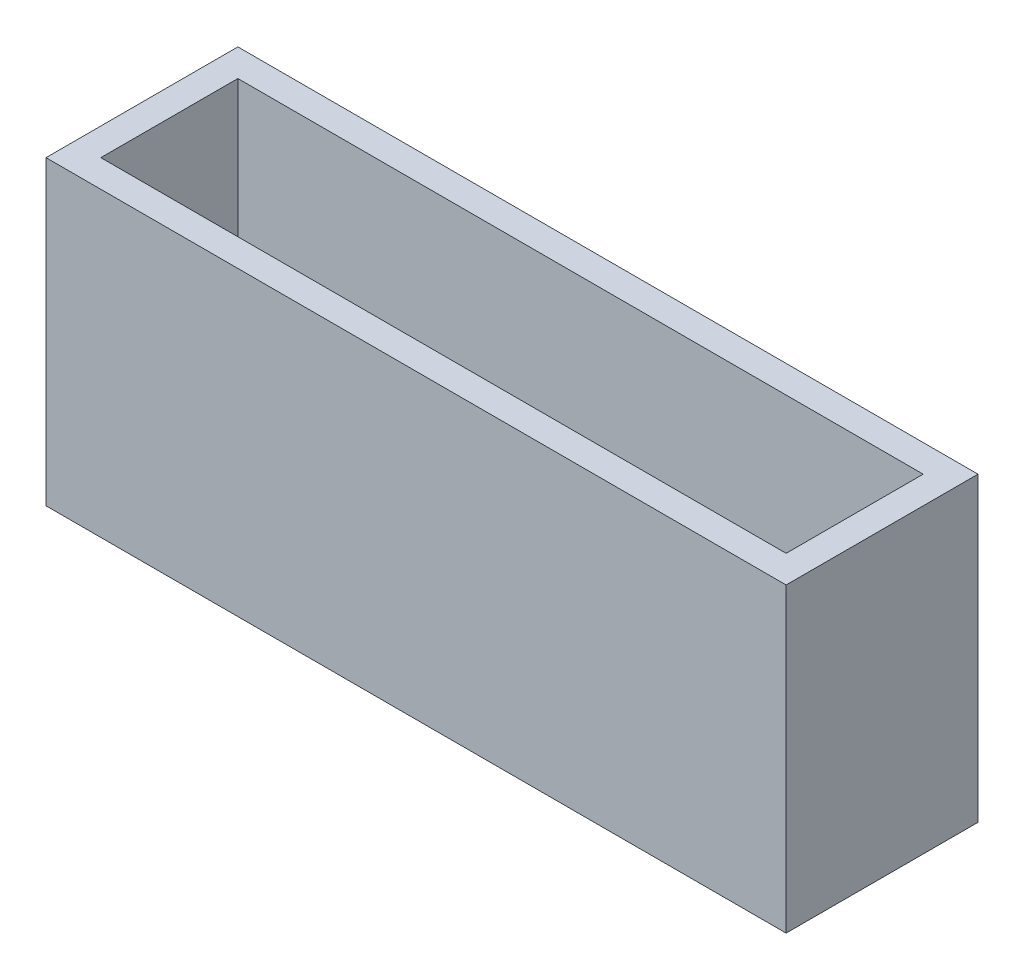
from build123d import *

# Parameters (mm, degrees)
SKETCH3_W           = 54
SKETCH3_H           = 14
SKETCH3_W_2         = 50
SKETCH3_H_2         = 10
BOSS_EXTRUDE1_DEPTH = 22
SKETCH4_W           = 7
SKETCH4_H           = 10
SKETCH4_R           = 1
BOSS_EXTRUDE2_DEPTH = 2


with BuildPart() as part:
    # Sketch3 → Boss-Extrude1 (new body)
    with BuildSketch(Plane(origin=(0, 0, 0), x_dir=(1, 0, 0), z_dir=(0, 1, 0))):
        Rectangle(SKETCH3_W, SKETCH3_H)
        Rectangle(SKETCH3_W_2, SKETCH3_H_2, mode=Mode.SUBTRACT)
    extrude(amount=BOSS_EXTRUDE1_DEPTH)

    # Sketch4 → Boss-Extrude2 (add)
    # profile 1 of 2: a face of its own
    with BuildSketch(Plane(origin=(0, 0, 0), x_dir=(1, 0, 0), z_dir=(0, 1, 0))):
        with Locations((-21.5, 0)):
            Rectangle(SKETCH4_W, SKETCH4_H)
        with Locations(Location((-21.5, 0, 0), (0, 0, 270))):
            Circle(SKETCH4_R, mode=Mode.SUBTRACT)
    # profile 2 of 2: a face of its own
    with BuildSketch(Plane(origin=(0, 0, 0), x_dir=(1, 0, 0), z_dir=(0, 1, 0))):
        with Locations((21.5, 0)):
            Rectangle(SKETCH4_W, SKETCH4_H)
        with Locations(Location((21.5, 0, 0), (0, 0, 270))):
            Circle(SKETCH4_R, mode=Mode.SUBTRACT)
    extrude(amount=BOSS_EXTRUDE2_DEPTH)


solid = part.part
